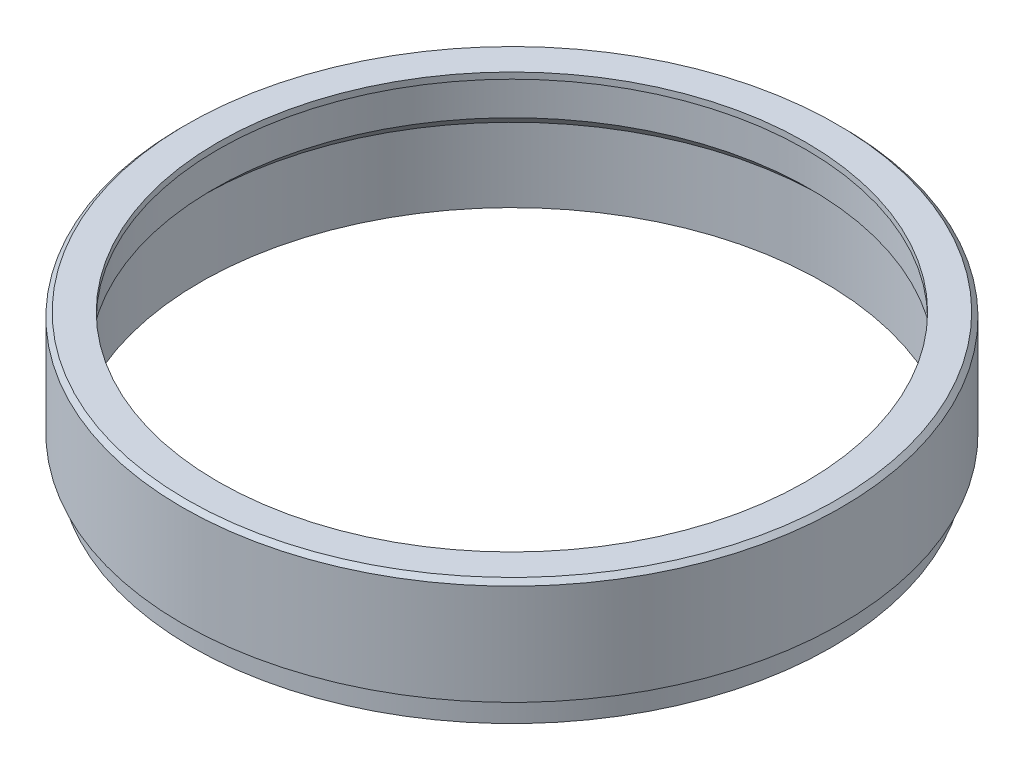
from build123d import *


with BuildPart() as part:
    # Sketch1 → Revolve1 (revolve)
    with BuildSketch(Plane.XY):
        Polygon((-35, 3.2), (-35, 11.5), (-33.5, 13), (-33.5, 17.1), (-33, 17.1), (-33, 17.8), (-36.5, 17.8), (-37, 17.3), (-37, 6), (-35.95, 6), (-35.95, 3.2), align=None)
    revolve(axis=Axis((0, 0, 0), (0, -1, 0)))


solid = part.part
